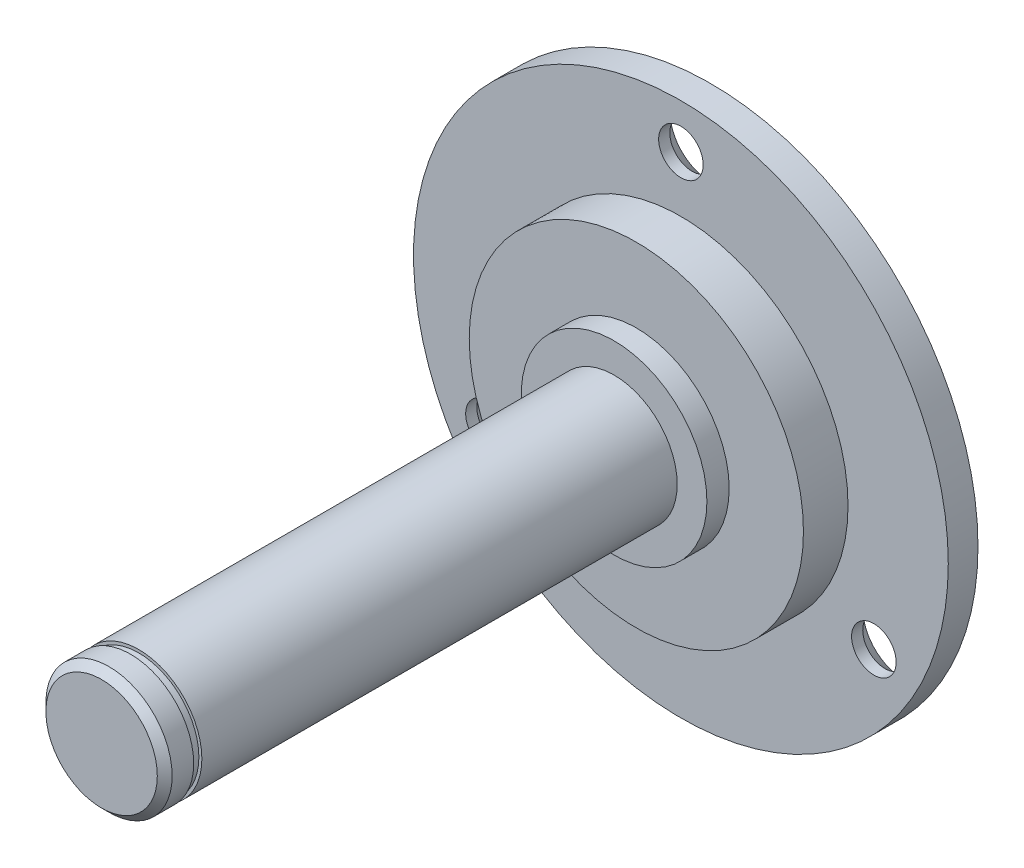
from build123d import *

# Parameters (mm, degrees)
SKETCH_1_R                     = 36
EXTRUDE_1_DEPTH                = 4
SKETCH_2_R                     = 22.5
EXTRUDE_2_DEPTH                = 6
SKETCH_3_R                     = 12.5
EXTRUDE_3_DEPTH                = 3
SKETCH_4_R                     = 8.5
EXTRUDE_4_DEPTH                = 64
SKETCH_5_R                     = 8.1
EXTRUDE_5_DEPTH                = 1.1
SKETCH_6_R                     = 8.5
EXTRUDE_6_DEPTH                = 3.9
CHAMFER_1_SIZE                 = 1
HOLE_WIZARD_6_0_6_1_AT_2_COUNT = 2
HOLE_WIZARD_6_0_6_1_AT_2_PITCH = 51.961524227
HOLE_WIZARD_6_0_6_1_AT_3_COUNT = 2
HOLE_WIZARD_6_0_6_1_AT_3_PITCH = 51.961524227
CUT_EXTRUDE_START              = -5.5
CUT_EXTRUDE_1_DEPTH            = 92.019428096


with BuildPart() as part:
    # 草图1 → 凸台-拉伸1 (new body)
    with BuildSketch(Plane.XY):
        Circle(SKETCH_1_R)
    extrude(amount=EXTRUDE_1_DEPTH)

    # 草图2 → 凸台-拉伸2 (add)
    with BuildSketch(Plane.XY.offset(4)):
        Circle(SKETCH_2_R)
    extrude(amount=EXTRUDE_2_DEPTH)

    # 草图3 → 凸台-拉伸3 (add)
    with BuildSketch(Plane.XY.offset(10)):
        Circle(SKETCH_3_R)
    extrude(amount=EXTRUDE_3_DEPTH)

    # 草图4 → 凸台-拉伸4 (add)
    with BuildSketch(Plane.XY.offset(13)):
        Circle(SKETCH_4_R)
    extrude(amount=EXTRUDE_4_DEPTH)

    # 草图5 → 凸台-拉伸5 (add)
    with BuildSketch(Plane.XY.offset(77)):
        Circle(SKETCH_5_R)
    extrude(amount=EXTRUDE_5_DEPTH)

    # 草图6 → 凸台-拉伸6 (add)
    with BuildSketch(Plane.XY.offset(78.1)):
        Circle(SKETCH_6_R)
    extrude(amount=EXTRUDE_6_DEPTH)

    # 倒角1
    chamfer_1_edges = [part.edges().sort_by_distance(p)[0] for p in [
        (-8.5, 0, 82),
    ]]
    chamfer(chamfer_1_edges, length=CHAMFER_1_SIZE)

    # 草图8 → Ø6.0 (6) 直径孔1 (revolve, cut)
    with BuildSketch(Plane(origin=(-25.980762114, -15, 0), x_dir=(0, 1, 0), z_dir=(1, 0, 0))):
        Polygon((0, 0), (0, 4), (3, 4), (3, 2.5), (5.5, 0), align=None)
    hole_wizard_6_0_6_1 = revolve(axis=Axis((-25.980762114, -15, -6.35), (0, 0, 1)), mode=Mode.SUBTRACT)

    # Ø6.0 (6) 直径孔1 at 2: Ø6.0 (6) 直径孔1 ×2
    with Locations(*[Vector(0.499999999999998, 0.8660254037844398, 0) * (i * HOLE_WIZARD_6_0_6_1_AT_2_PITCH) for i in range(1, HOLE_WIZARD_6_0_6_1_AT_2_COUNT)]):
        add(hole_wizard_6_0_6_1, mode=Mode.SUBTRACT)

    # Ø6.0 (6) 直径孔1 at 3: Ø6.0 (6) 直径孔1 ×2
    with Locations(*[(i * HOLE_WIZARD_6_0_6_1_AT_3_PITCH, 0, 0) for i in range(1, HOLE_WIZARD_6_0_6_1_AT_3_COUNT)]):
        add(hole_wizard_6_0_6_1, mode=Mode.SUBTRACT)

    # 草图9 → 切除-拉伸1 (cut, through all)
    with BuildSketch(Plane(origin=(0, 0, 0), x_dir=(0, 0, -1), z_dir=(1, 0, 0)).offset(CUT_EXTRUDE_START)):
        with BuildLine():
            Line((-72.5, 2.5), (-57.5, 2.5))
            ThreePointArc((-57.5, 2.5), (-55, 0), (-57.5, -2.5))
            Line((-57.5, -2.5), (-72.5, -2.5))
            ThreePointArc((-72.5, -2.5), (-75, 0), (-72.5, 2.5))
        make_face()
    extrude(amount=-CUT_EXTRUDE_1_DEPTH, mode=Mode.SUBTRACT)


solid = part.part
